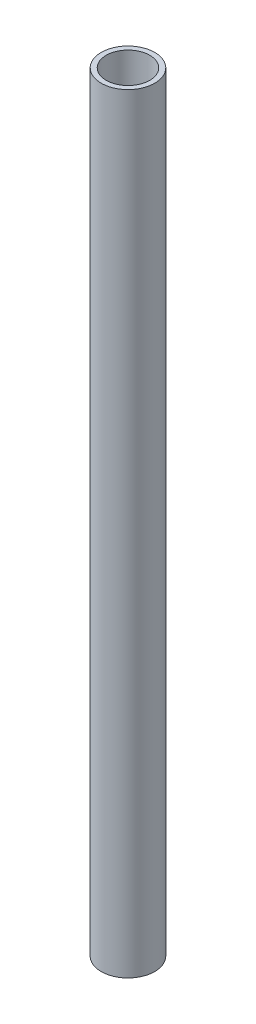
from build123d import *

# Parameters (mm, degrees)
SKETCH1_R           = 7.9375
SKETCH1_R_2         = 6.4643
BOSS_EXTRUDE1_DEPTH = 228.426971443


with BuildPart() as part:
    # Sketch1 → Boss-Extrude1 (new body)
    with BuildSketch(Plane(origin=(0, 0, 0), x_dir=(1, 0, 0), z_dir=(0, 1, 0))):
        with Locations(Location((0, 0, 0), (0, 0, 180))):
            Circle(SKETCH1_R)
        with Locations(Location((0, 0, 0), (0, 0, 180))):
            Circle(SKETCH1_R_2, mode=Mode.SUBTRACT)
    extrude(amount=BOSS_EXTRUDE1_DEPTH)


solid = part.part
